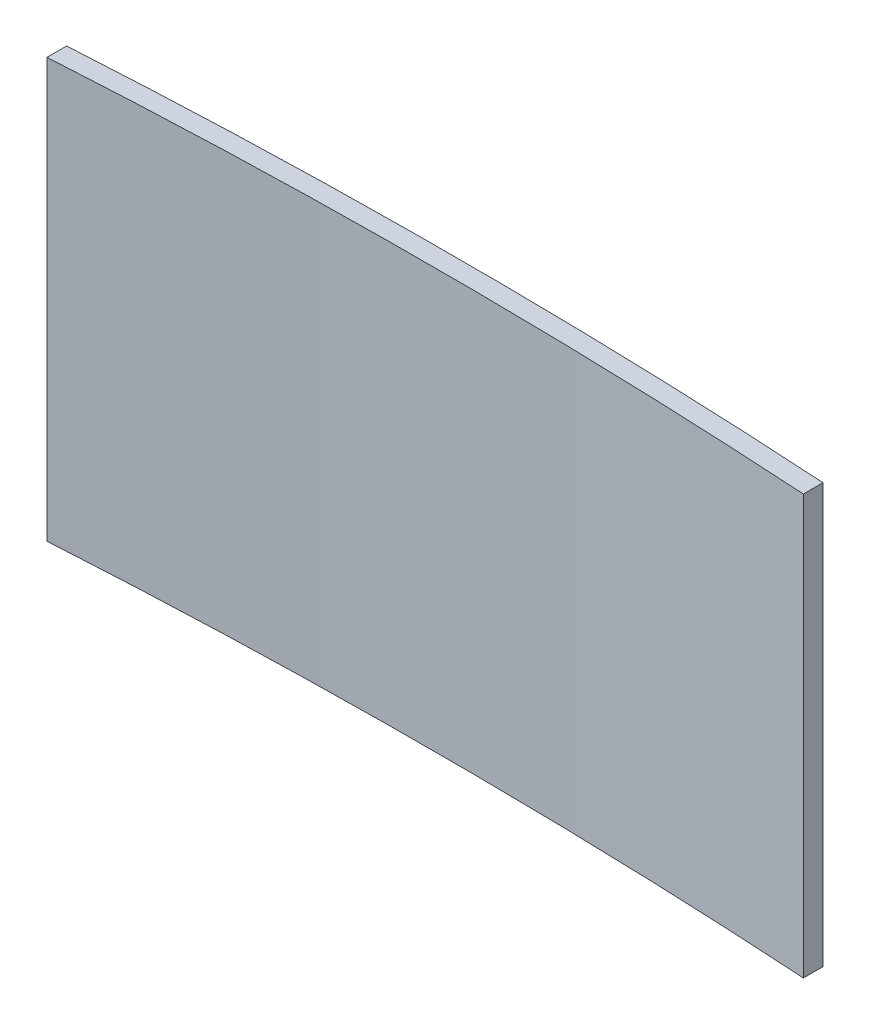
from build123d import *

# Parameters (mm, degrees)
BOSS_EXTRUDE1_DEPTH = 271.78
SKETCH4_W           = 12.7
SKETCH4_H           = 12.7
BOSS_EXTRUDE2_DEPTH = 7.62
CUT_EXTRUDE1_DEPTH  = 562.161666545
CUT_EXTRUDE2_DEPTH  = 562.161666545


with BuildPart() as part:
    # Sketch3 → Boss-Extrude1 (new body)
    with BuildSketch(Plane(origin=(0, 0, 0), x_dir=(1, 0, 0), z_dir=(0, 1, 0))):
        with BuildLine():
            Line((0, 0), (0, 12.72441479))
            add(Edge.make_bspline(
                [(0, 12.72441479), (20.233071215, 13.977592464), (60.992424476, 16.189695121), (142.741781458, 19.364277715), (245.2677848, 20.95714819), (347.793788142, 19.364277715), (429.543145124, 16.189695121), (470.302498385, 13.977592464), (490.5355696, 12.72441479)],
                knots=[0.001601193, 0.001601193, 0.001601193, 0.001601193, 0.125, 0.25, 0.5, 0.75, 0.875, 0.998398807, 0.998398807, 0.998398807, 0.998398807], degree=3))
            Line((490.5355696, 12.72441479), (490.5355696, 0))
            add(Edge.make_bspline(
                [(0, 0), (245.2677848, 15.24), (490.5355696, 0)],
                knots=[0, 0, 0, 1, 1, 1], degree=2))
        make_face()
    extrude(amount=BOSS_EXTRUDE1_DEPTH)

    # Sketch4 → Boss-Extrude2 (add)
    with BuildSketch(Plane.XY.offset(-8.89)):
        with Locations((12.7, 232.918)):
            Rectangle(SKETCH4_W, SKETCH4_H)
        with Locations((465.1355696, 232.918)):
            Rectangle(SKETCH4_W, SKETCH4_H)
    boss_extrude2 = extrude(amount=-BOSS_EXTRUDE2_DEPTH)

    # Sketch5 → Cut-Extrude1 (cut, through all)
    with BuildSketch(Plane(origin=(0, 271.78, 0), x_dir=(1, 0, 0), z_dir=(0, 1, 0))):
        with BuildLine():
            Line((486.135566794, 12.994491849), (486.135566794, 38.953188641))
            Line((486.135566794, 38.953188641), (439.07442157, 31.940350217))
            Line((439.07442157, 31.940350217), (441.530786222, 15.456392275))
            add(Edge.make_bspline(
                [(486.135566794, 12.994491849), (471.272243027, 13.898556621), (456.401448688, 14.719348346), (441.530786222, 15.456392275)],
                knots=[0.01054573, 0.01054573, 0.01054573, 0.01054573, 0.101185718, 0.101185718, 0.101185718, 0.101185718], degree=3))
        make_face()
    extrude(amount=-CUT_EXTRUDE1_DEPTH, mode=Mode.SUBTRACT)

    # Mirror2: Boss-Extrude2 across plane
    add(boss_extrude2.mirror(Plane.ZY.offset(-245.2677848)))

    # Sketch6 → Cut-Extrude2 (cut, through all)
    with BuildSketch(Plane(origin=(0, 271.78, 0), x_dir=(1, 0, 0), z_dir=(0, 1, 0))):
        with BuildLine():
            Line((19.05, 13.858474742), (19.05, 29.417888146))
            Line((19.05, 29.417888146), (39.010886376, 22.948973115))
            Line((39.010886376, 22.948973115), (39.425645252, 14.970033585))
            add(Edge.make_bspline(
                [(39.425645252, 14.970033585), (32.633208906, 14.616951167), (25.841085641, 14.24641647), (19.05, 13.858474742)],
                knots=[0.918276722, 0.918276722, 0.918276722, 0.918276722, 0.959678947, 0.959678947, 0.959678947, 0.959678947], degree=3))
        make_face()
    extrude(amount=-CUT_EXTRUDE2_DEPTH, mode=Mode.SUBTRACT)


solid = part.part
